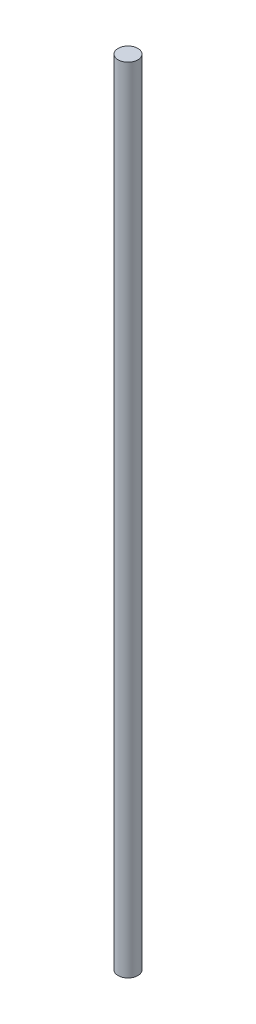
from build123d import *

# Parameters (mm, degrees)
SKETCH_1_R      = 2.5
EXTRUDE_1_DEPTH = 200


with BuildPart() as part:
    # 草图1 → 凸台-拉伸1 (new body)
    with BuildSketch(Plane(origin=(0, 0, 0), x_dir=(1, 0, 0), z_dir=(0, 1, 0))):
        with Locations(Location((0, 0, 0), (0, 0, 270))):
            Circle(SKETCH_1_R)
    extrude(amount=EXTRUDE_1_DEPTH)


solid = part.part
